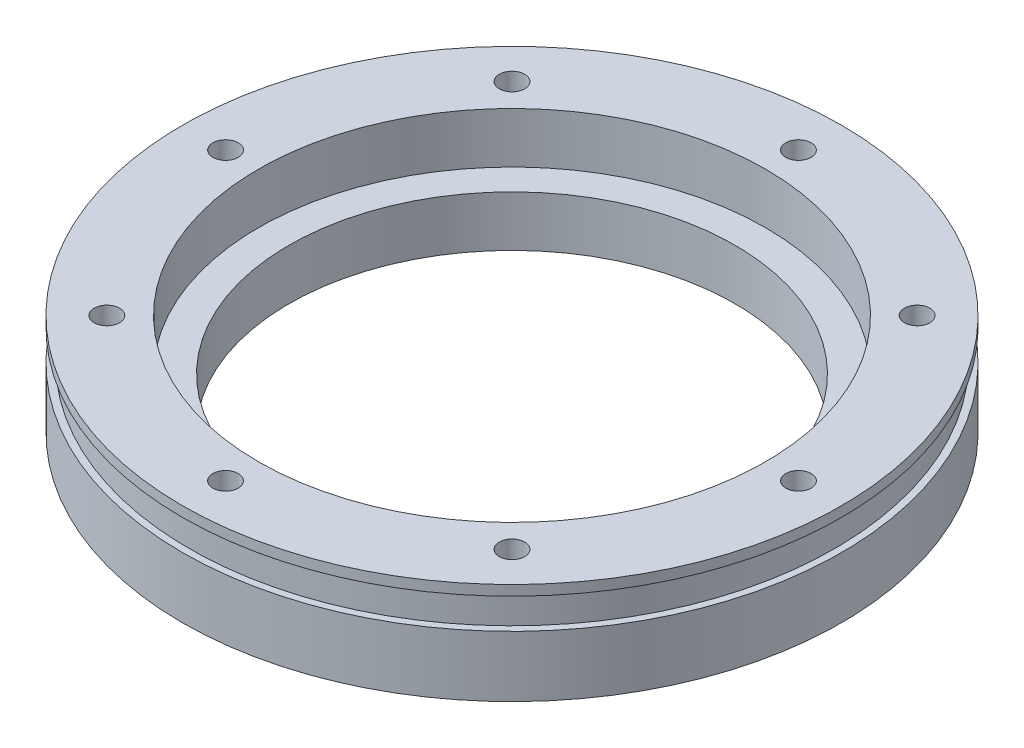
from build123d import *

# Parameters (mm, degrees)
SKETCH1_R                = 63.66
BOSS_EXTRUDE1_DEPTH      = 10
SKETCH2_R                = 65
BOSS_EXTRUDE2_DEPTH      = 2
BOSS_EXTRUDE3_DEPTH      = 10
BOSS_EXTRUDE3_DEPTH_BACK = 2
SKETCH3_R                = 65
SKETCH4_R                = 2.5
SKETCH4_R_2              = 44
CUT_EXTRUDE1_DEPTH       = 95.074438611
SKETCH5_R                = 50
CUT_EXTRUDE2_DEPTH       = 10


with BuildPart() as part:
    # Sketch1 → Boss-Extrude1 (new body)
    with BuildSketch(Plane(origin=(0, 0, 0), x_dir=(1, 0, 0), z_dir=(0, 1, 0))):
        with Locations(Location((0, 0, 0), (0, 0, 270))):
            Circle(SKETCH1_R)
    extrude(amount=BOSS_EXTRUDE1_DEPTH)

    # Sketch2 → Boss-Extrude2 (add)
    with BuildSketch(Plane(origin=(0, 10, 0), x_dir=(1, 0, 0), z_dir=(0, 1, 0))):
        with Locations(Location((0, 0, 0), (0, 0, 270))):
            Circle(SKETCH2_R)
    extrude(amount=-BOSS_EXTRUDE2_DEPTH)

    # Sketch3 → Boss-Extrude3 (add, two sides: drawn at the far end of the back side and taken through both)
    with BuildSketch(Plane.XZ.offset(-BOSS_EXTRUDE3_DEPTH_BACK)):
        with Locations(Location((0, 0, 0), (0, 0, 90))):
            Circle(SKETCH3_R)
    extrude(amount=BOSS_EXTRUDE3_DEPTH + BOSS_EXTRUDE3_DEPTH_BACK)

    # Sketch4 → Cut-Extrude1 (cut, through all)
    with BuildSketch(Plane(origin=(0, 10, 0), x_dir=(1, 0, 0), z_dir=(0, 1, 0))):
        with Locations(Location((0, 56.5, 0), (0, 0, 270))):
            Circle(SKETCH4_R)
        with Locations(Location((39.951533137, 39.951533137, 0), (0, 0, 270))):
            Circle(SKETCH4_R)
        with Locations(Location((56.5, 0, 0), (0, 0, 270))):
            Circle(SKETCH4_R)
        with Locations(Location((39.951533137, -39.951533137, 0), (0, 0, 270))):
            Circle(SKETCH4_R)
        with Locations(Location((0, -56.5, 0), (0, 0, 270))):
            Circle(SKETCH4_R)
        with Locations(Location((-39.951533137, -39.951533137, 0), (0, 0, 270))):
            Circle(SKETCH4_R)
        with Locations(Location((-56.5, 0, 0), (0, 0, 270))):
            Circle(SKETCH4_R)
        with Locations(Location((-39.951533137, 39.951533137, 0), (0, 0, 270))):
            Circle(SKETCH4_R)
        with Locations(Location((0, 0, 0), (0, 0, 270))):
            Circle(SKETCH4_R_2)
    extrude(amount=-CUT_EXTRUDE1_DEPTH, mode=Mode.SUBTRACT)

    # Sketch5 → Cut-Extrude2 (cut)
    with BuildSketch(Plane(origin=(0, 10, 0), x_dir=(1, 0, 0), z_dir=(0, 1, 0))):
        with Locations(Location((0, 0, 0), (0, 0, 270))):
            Circle(SKETCH5_R)
    extrude(amount=-CUT_EXTRUDE2_DEPTH, mode=Mode.SUBTRACT)


solid = part.part
